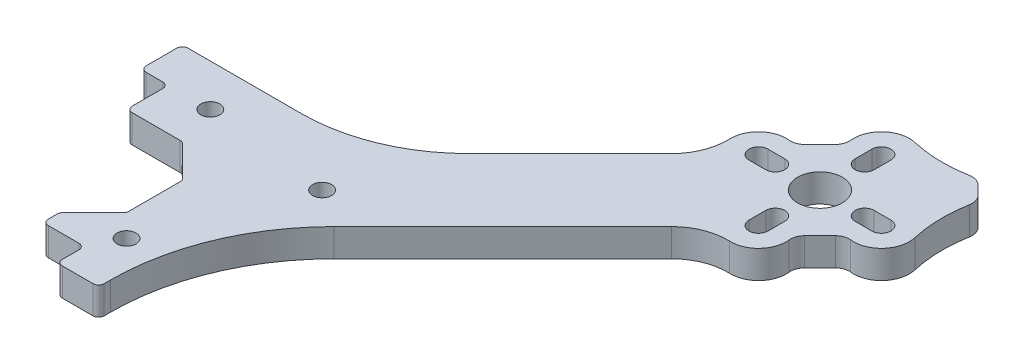
from build123d import *

# Parameters (mm, degrees)
SKETCH1_R            = 4
BOSS_EXTRUDE1_DEPTH  = 2.5
CUT_EXTRUDE1_DEPTH   = 10
FILLET1_R            = 2.5
FILLET2_R            = 1
M3_CLEARANCE_HOLE1_D = 3.4
M3_CLEARANCE_HOLE2_D = 3.4


with BuildPart() as part:
    # Sketch1 → Boss-Extrude1 (new, symmetric)
    with BuildSketch(Plane(origin=(0, 0, 0), x_dir=(1, 0, 0), z_dir=(0, 1, 0))):
        with BuildLine():
            Line((0, 37.5), (0, 45))
            Line((0, 45), (21.25988463, 45))
            ThreePointArc((21.25988463, 45), (32.740387601, 47.283614025), (42.473088065, 53.786796564))
            Line((42.473088065, 53.786796564), (60.630111199, 71.943819698))
            ThreePointArc((60.630111199, 71.943819698), (62.864579349, 75.353330401), (63.552689718, 79.371304426))
            ThreePointArc((63.552689718, 79.371304426), (65.137560566, 83.204452196), (69.070514812, 84.522294498))
            ThreePointArc((69.070514812, 84.522294498), (70.16592161, 84.652219255), (71.098782729, 85.240918353))
            Line((71.098782729, 85.240918353), (73.858107414, 88.000243038))
            ThreePointArc((73.858107414, 88.000243038), (74.446806512, 88.933104157), (74.576731268, 90.028510955))
            ThreePointArc((74.576731268, 90.028510955), (76.231825981, 94.29022854), (80.660715996, 95.424472129))
            ThreePointArc((80.660715996, 95.424472129), (86.294292266, 94.799388668), (91.923881554, 95.45941546))
            Line((91.923881554, 95.45941546), (95.45941546, 91.923881554))
            ThreePointArc((95.45941546, 91.923881554), (94.799388668, 86.294292266), (95.424472129, 80.660715996))
            ThreePointArc((95.424472129, 80.660715996), (94.29022854, 76.231825981), (90.028510955, 74.576731268))
            ThreePointArc((90.028510955, 74.576731268), (88.933104157, 74.446806512), (88.000243038, 73.858107414))
            Line((88.000243038, 73.858107414), (85.240918353, 71.098782729))
            ThreePointArc((85.240918353, 71.098782729), (84.652219255, 70.16592161), (84.522294498, 69.070514812))
            ThreePointArc((84.522294498, 69.070514812), (83.204452196, 65.137560566), (79.371304426, 63.552689718))
            ThreePointArc((79.371304426, 63.552689718), (75.353330401, 62.864579349), (71.943819698, 60.630111199))
            Line((71.943819698, 60.630111199), (41.715728753, 30.402020254))
            ThreePointArc((41.715728753, 30.402020254), (33.0448187, 17.425086301), (30, 2.117749006))
            Line((30, 2.117749006), (30, 0))
            Line((30, 0), (22.5, 0))
            Line((22.5, 0), (22.5, 5))
            Line((22.5, 5), (15, 5))
            Line((15, 5), (15, 30))
            Line((15, 30), (5, 30))
            Line((5, 30), (5, 37.5))
            Line((5, 37.5), (0, 37.5))
        make_face()
        with Locations(Location((79.549512883, 79.549512883, 0), (0, 0, 270))):
            Circle(SKETCH1_R, mode=Mode.SUBTRACT)
        with BuildLine():
            Line((77.849512883, 87.549512883), (77.849512883, 90.549512883))
            ThreePointArc((77.849512883, 90.549512883), (79.549512883, 92.249512883), (81.249512883, 90.549512883))
            Line((81.249512883, 90.549512883), (81.249512883, 87.549512883))
            ThreePointArc((81.249512883, 87.549512883), (79.549512883, 85.849512883), (77.849512883, 87.549512883))
        make_face(mode=Mode.SUBTRACT)
        with BuildLine():
            Line((87.549512883, 81.249512883), (90.549512883, 81.249512883))
            ThreePointArc((90.549512883, 81.249512883), (92.249512883, 79.549512883), (90.549512883, 77.849512883))
            Line((90.549512883, 77.849512883), (87.549512883, 77.849512883))
            ThreePointArc((87.549512883, 77.849512883), (85.849512883, 79.549512883), (87.549512883, 81.249512883))
        make_face(mode=Mode.SUBTRACT)
        with BuildLine():
            Line((81.249512883, 71.549512883), (81.249512883, 68.549512883))
            ThreePointArc((81.249512883, 68.549512883), (79.549512883, 66.849512883), (77.849512883, 68.549512883))
            Line((77.849512883, 68.549512883), (77.849512883, 71.549512883))
            ThreePointArc((77.849512883, 71.549512883), (79.549512883, 73.249512883), (81.249512883, 71.549512883))
        make_face(mode=Mode.SUBTRACT)
        with BuildLine():
            Line((71.549512883, 77.849512883), (68.549512883, 77.849512883))
            ThreePointArc((68.549512883, 77.849512883), (66.849512883, 79.549512883), (68.549512883, 81.249512883))
            Line((68.549512883, 81.249512883), (71.549512883, 81.249512883))
            ThreePointArc((71.549512883, 81.249512883), (73.249512883, 79.549512883), (71.549512883, 77.849512883))
        make_face(mode=Mode.SUBTRACT)
    extrude(amount=BOSS_EXTRUDE1_DEPTH, both=True)

    # Sketch2 → Cut-Extrude1 (cut)
    with BuildSketch(Plane(origin=(0, 2.5, 0), x_dir=(1, 0, 0), z_dir=(0, 1, 0))):
        Polygon((21, 24), (15, 30), (15, 8), (21, 14), align=None)
    extrude(amount=-CUT_EXTRUDE1_DEPTH, mode=Mode.SUBTRACT)

    # Fillet1
    fillet1_edges = [part.edges().sort_by_distance(p)[0] for p in [
        (91.923881554, 0, -95.45941546),
        (95.45941546, 0, -91.923881554),
    ]]
    fillet(fillet1_edges, radius=FILLET1_R)

    # Fillet2
    fillet2_edges = [part.edges().sort_by_distance(p)[0] for p in [
        (21, 0, -14),
        (15, 0, -8),
        (21, 0, -24),
        (30, 0, 0),
        (22.5, 0, 0),
        (22.5, 0, -5),
        (15, 0, -5),
        (15, 0, -30),
        (5, 0, -30),
        (5, 0, -37.5),
        (0, 0, -37.5),
        (0, 0, -45),
    ]]
    fillet(fillet2_edges, radius=FILLET2_R)

    # M3 Clearance Hole1 (through all)
    with Locations(Plane(origin=(0, 2.5, 0), x_dir=(1, 0, 0), z_dir=(0, 1, 0))):
        with Locations((35, 35)):
            Hole(M3_CLEARANCE_HOLE1_D / 2)

    # M3 Clearance Hole2 (through all)
    with Locations(Plane(origin=(0, 2.5, 0), x_dir=(1, 0, 0), z_dir=(0, 1, 0))):
        with Locations((12.5, 37.5), (25, 10)):
            Hole(M3_CLEARANCE_HOLE2_D / 2)


solid = part.part
